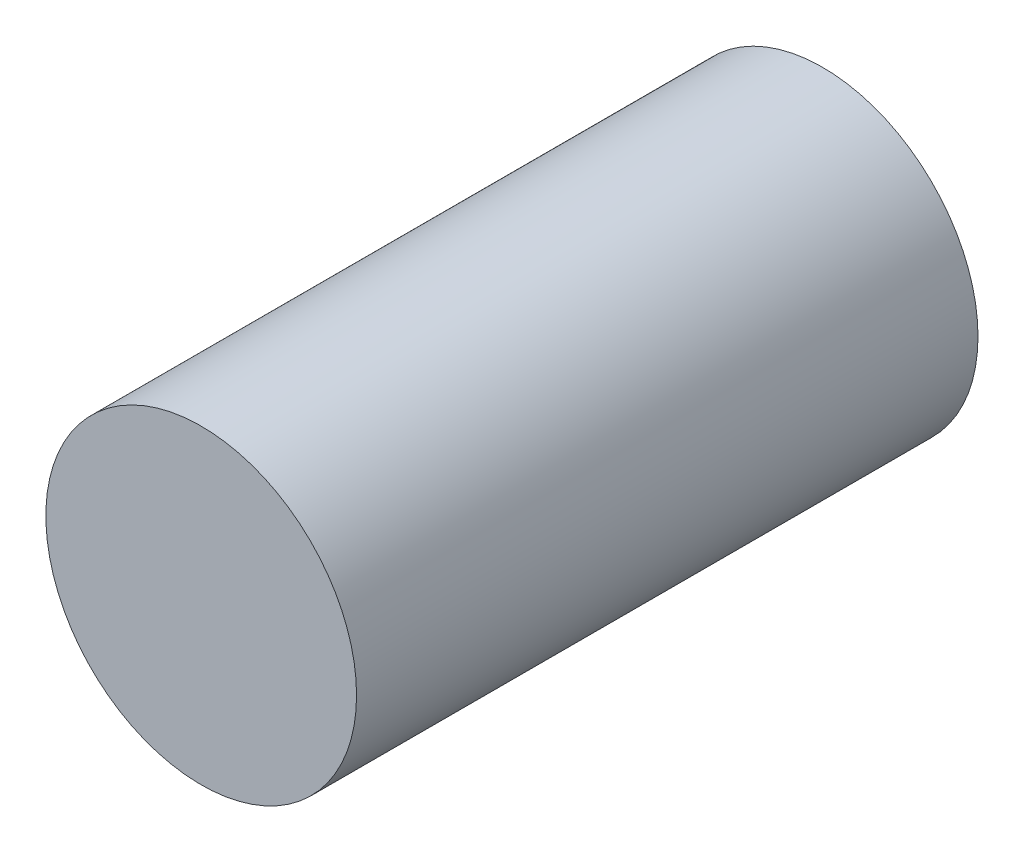
from build123d import *

# Parameters (mm, degrees)
SKETCH1_R                 = 6
EX_PLANET_PIN_12X24_DEPTH = 12


with BuildPart() as part:
    # Sketch1 → EX_Planet_Pin_Ø12x24 (new, symmetric)
    with BuildSketch(Plane.XY):
        Circle(SKETCH1_R)
    extrude(amount=EX_PLANET_PIN_12X24_DEPTH, both=True)


solid = part.part
